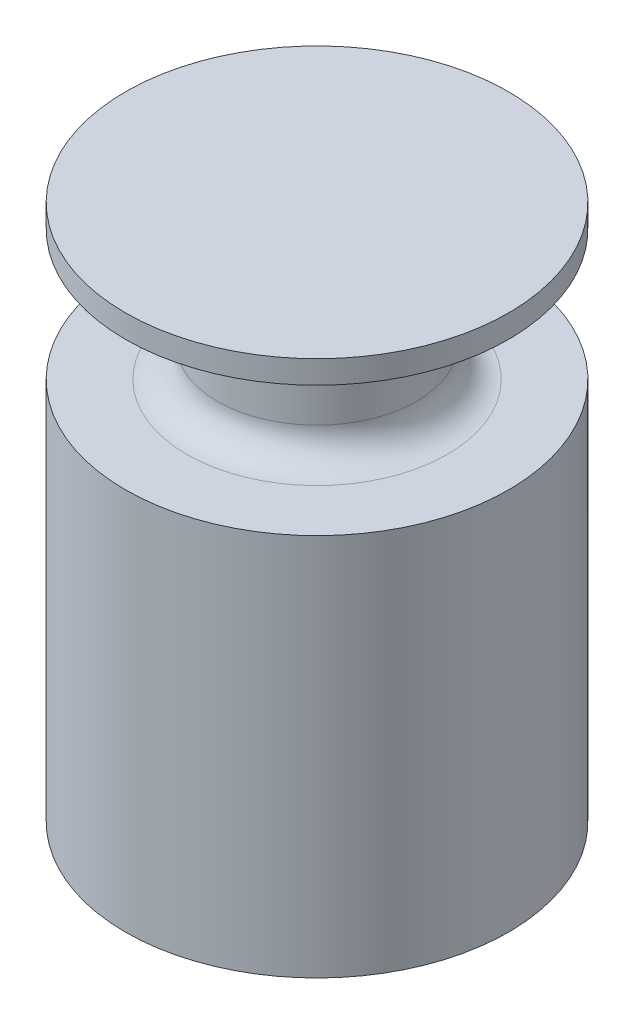
from build123d import *

# Parameters (mm, degrees)
SKETCH1_R           = 25
BOSS_EXTRUDE1_DEPTH = 70
SKETCH2_OUTSIDE_W   = 71.9
SKETCH2_OUTSIDE_H   = 71.9
SKETCH2_OUTSIDE_R   = 13
CUT_EXTRUDE1_DEPTH  = 17
FILLET1_R           = 4


with BuildPart() as part:
    # Sketch1 → Boss-Extrude1 (new body)
    with BuildSketch(Plane(origin=(0, 0, 0), x_dir=(1, 0, 0), z_dir=(0, 1, 0))):
        with Locations(Location((0, 0, 0), (0, 0, 270))):
            Circle(SKETCH1_R)
    extrude(amount=BOSS_EXTRUDE1_DEPTH)

    # Sketch2 outside → Cut-Extrude1 (cut)
    with BuildSketch(Plane(origin=(0, 67, 0), x_dir=(1, 0, 0), z_dir=(0, 1, 0))):
        Rectangle(SKETCH2_OUTSIDE_W, SKETCH2_OUTSIDE_H)
        with Locations(Location((0, 0, 0), (0, 0, 270))):
            Circle(SKETCH2_OUTSIDE_R, mode=Mode.SUBTRACT)
    extrude(amount=-CUT_EXTRUDE1_DEPTH, mode=Mode.SUBTRACT)

    # Fillet1
    fillet1_edges = [part.edges().sort_by_distance(p)[0] for p in [
        (0, 67, -13),
        (0, 50, -13),
    ]]
    fillet(fillet1_edges, radius=FILLET1_R)


solid = part.part
